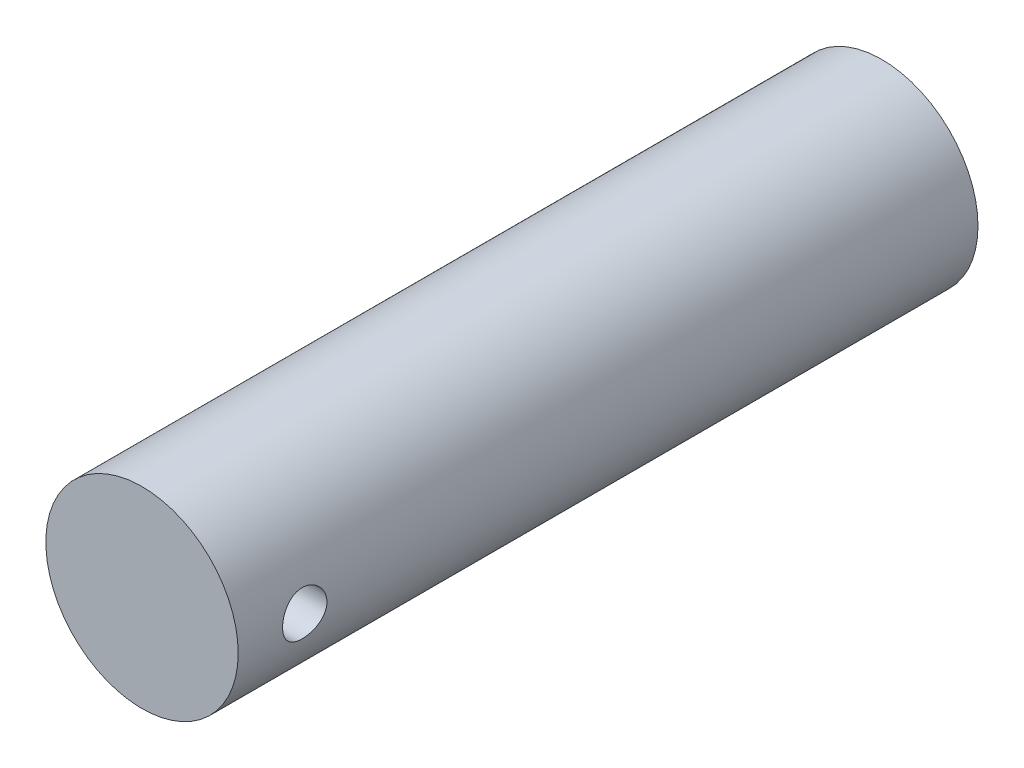
from build123d import *

# Parameters (mm, degrees)
SKETCH1_R           = 6.5
BOSS_EXTRUDE1_DEPTH = 50
SKETCH2_R           = 1.5
CUT_EXTRUDE1_DEPTH  = 53.069664873


with BuildPart() as part:
    # Sketch1 → Boss-Extrude1 (new body)
    with BuildSketch(Plane.XY):
        Circle(SKETCH1_R)
    extrude(amount=BOSS_EXTRUDE1_DEPTH)

    # Sketch2 → Cut-Extrude1 (cut, through all)
    with BuildSketch(Plane(origin=(6.5, 0, 0), x_dir=(0, 0, -1), z_dir=(1, 0, 0))):
        with Locations((-45.5, 0)):
            Circle(SKETCH2_R)
    extrude(amount=-CUT_EXTRUDE1_DEPTH, mode=Mode.SUBTRACT)


solid = part.part
